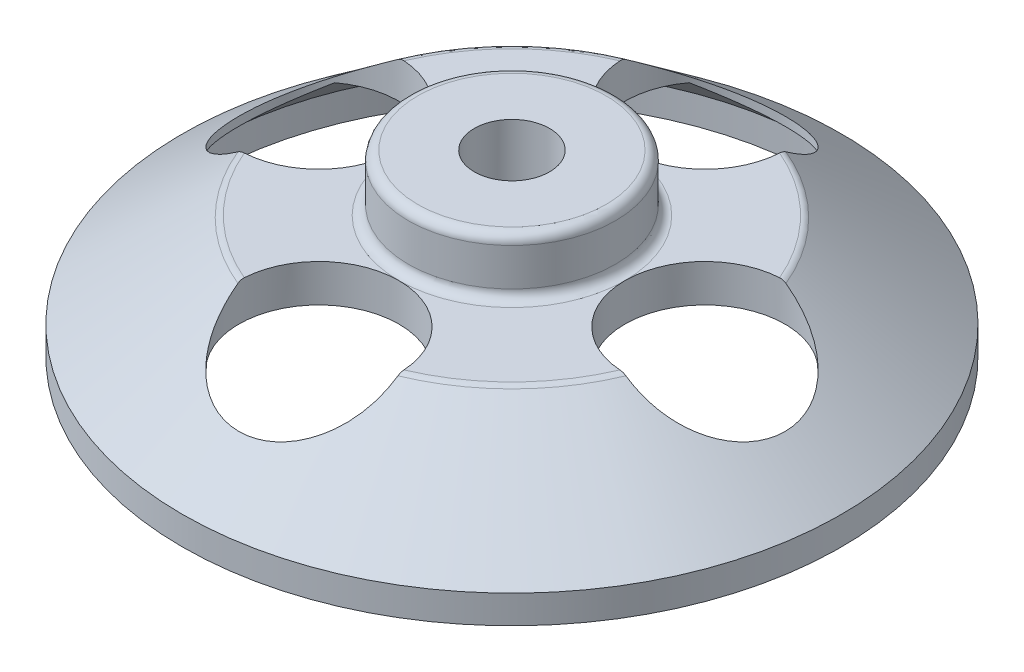
from build123d import *

# Parameters (mm, degrees)
SKETCH1_R           = 17.5
SKETCH1_R_2         = 16.5
BOSS_EXTRUDE1_DEPTH = 1.5
SKETCH2_R           = 17.5
BOSS_EXTRUDE2_DEPTH = 5
BOSS_EXTRUDE2_TAPER = 52.4
SKETCH4_R           = 16.5
CUT_EXTRUDE1_DEPTH  = 3
CUT_EXTRUDE1_DRAFT  = -47.3
SKETCH5_R           = 5.5
BOSS_EXTRUDE3_DEPTH = 3
FILLET1_R           = 0.5
SKETCH6_R           = 2
CUT_EXTRUDE2_DEPTH  = 27.509432416
FILLET2_R           = 0.5
FILLET3_R           = 0.5
SKETCH7_R           = 4.25
CUT_EXTRUDE3_DEPTH  = 26.588083301


with BuildPart() as part:
    # Sketch1 → Boss-Extrude1 (new body)
    with BuildSketch(Plane(origin=(0, 0, 0), x_dir=(1, 0, 0), z_dir=(0, 1, 0))):
        with Locations(Location((0, 0, 0), (0, 0, 270))):
            Circle(SKETCH1_R)
        with Locations(Location((0, 0, 0), (0, 0, 270))):
            Circle(SKETCH1_R_2, mode=Mode.SUBTRACT)
    extrude(amount=BOSS_EXTRUDE1_DEPTH)

    # Sketch2 → Boss-Extrude2 (add)
    with BuildSketch(Plane(origin=(0, 1.5, 0), x_dir=(1, 0, 0), z_dir=(0, 1, 0))):
        with Locations(Location((0, 0, 0), (0, 0, 270))):
            Circle(SKETCH2_R)
    extrude(amount=BOSS_EXTRUDE2_DEPTH, taper=BOSS_EXTRUDE2_TAPER)


with BuildPart() as cut_extrude1_tool:
    # Sketch4 → Cut-Extrude1 (with draft: the straight prism first)
    with BuildSketch(Plane.XZ.offset(-1.5)):
        with Locations(Location((0, 0, 0), (0, 0, 270))):
            Circle(SKETCH4_R)
    extrude(amount=-CUT_EXTRUDE1_DEPTH)
    # Cut-Extrude1: the draft: its side faces are tilted about the plane it starts from
    cut_extrude1_sides = [cut_extrude1_tool.faces().sort_by_distance(p)[0] for p in [
        (0, 3, 16.5),
    ]]
    draft(cut_extrude1_sides, Plane.XZ.offset(-1.5), CUT_EXTRUDE1_DRAFT)


with BuildPart() as part_1:
    add(part.part)

    # Cut-Extrude1: cut by cut_extrude1_tool
    add(cut_extrude1_tool.part, mode=Mode.SUBTRACT)

    # Sketch5 → Boss-Extrude3 (add)
    with BuildSketch(Plane(origin=(0, 6.5, 0), x_dir=(1, 0, 0), z_dir=(0, 1, 0))):
        with Locations(Location((0, 0, 0), (0, 0, 270))):
            Circle(SKETCH5_R)
    extrude(amount=BOSS_EXTRUDE3_DEPTH)

    # Fillet1
    fillet1_edges = [part_1.edges().sort_by_distance(p)[0] for p in [
        (0, 9.5, -5.5),
    ]]
    fillet(fillet1_edges, radius=FILLET1_R)

    # Sketch6 → Cut-Extrude2 (cut, through all)
    with BuildSketch(Plane(origin=(0, 9.5, 0), x_dir=(1, 0, 0), z_dir=(0, 1, 0))):
        with Locations(Location((0, 0, 0), (0, 0, 270))):
            Circle(SKETCH6_R)
    extrude(amount=-CUT_EXTRUDE2_DEPTH, mode=Mode.SUBTRACT)

    # Fillet2
    fillet2_edges = [part_1.edges().sort_by_distance(p)[0] for p in [
        (0, 6.5, -5.5),
    ]]
    fillet(fillet2_edges, radius=FILLET2_R)

    # Fillet3
    fillet3_edges = [part_1.edges().sort_by_distance(p)[0] for p in [
        (0, 6.5, -11.007367671),
    ]]
    fillet(fillet3_edges, radius=FILLET3_R)

    # Sketch7 → Cut-Extrude3 (cut, through all)
    with BuildSketch(Plane(origin=(0, 6.5, 0), x_dir=(1, 0, 0), z_dir=(0, 1, 0))):
        with Locations(Location((0, 10.25, 0), (0, 0, 270))):
            Circle(SKETCH7_R)
        with Locations(Location((10.25, 0, 0), (0, 0, 270.673562962))):
            Circle(SKETCH7_R)
        with Locations(Location((0, -10.25, 0), (0, 0, 269.99999999))):
            Circle(SKETCH7_R)
        with Locations(Location((-10.25, 0, 0), (0, 0, 269.326436338))):
            Circle(SKETCH7_R)
    extrude(amount=-CUT_EXTRUDE3_DEPTH, mode=Mode.SUBTRACT)


solid = part_1.part
